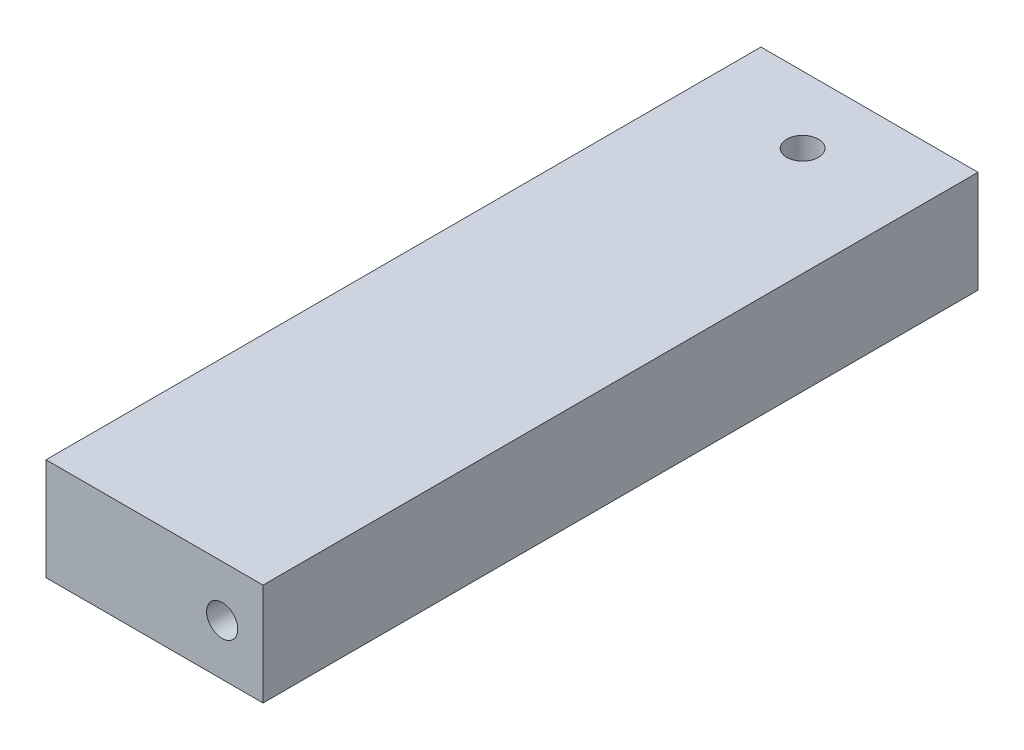
from build123d import *

# Parameters (mm, degrees)
SKETCH1_W           = 4.25
SKETCH1_H           = 14
BOSS_EXTRUDE1_DEPTH = 2
SCALE1_SCALE        = 10
SKETCH2_R           = 3.05
CUT_EXTRUDE1_DEPTH  = 143.03321973
SKETCH4_R           = 3.1
CUT_EXTRUDE2_DEPTH  = 82.304166761


with BuildPart() as part:
    # Sketch1 → Boss-Extrude1 (new body)
    with BuildSketch(Plane(origin=(0, 0, 0), x_dir=(1, 0, 0), z_dir=(0, 1, 0))):
        with Locations((-0.020531401, -5.881038647)):
            Rectangle(SKETCH1_W, SKETCH1_H)
    extrude(amount=BOSS_EXTRUDE1_DEPTH)


with BuildPart() as part_1:
    # Scale1: scaled about (-0.020531401, 1, 5.881038647)
    add(part.part.scale(SCALE1_SCALE).moved(Location((0.184782609, -9, -52.929347823))))

    # Sketch2 → Cut-Extrude1 (cut, through all)
    with BuildSketch(Plane(origin=(0, 0, -64.118961353), x_dir=(-1, 0, 0), z_dir=(0, 0, -1))):
        with Locations((-13.229468599, 1)):
            Circle(SKETCH2_R)
    extrude(amount=-CUT_EXTRUDE1_DEPTH, mode=Mode.SUBTRACT)

    # Sketch4 → Cut-Extrude2 (cut, through all)
    with BuildSketch(Plane(origin=(0, 11, 0), x_dir=(1, 0, 0), z_dir=(0, 1, 0))):
        with Locations(Location((-0.020531401, 51.018961353, 0), (0, 0, 270))):
            Circle(SKETCH4_R)
    extrude(amount=-CUT_EXTRUDE2_DEPTH, mode=Mode.SUBTRACT)


solid = part_1.part
